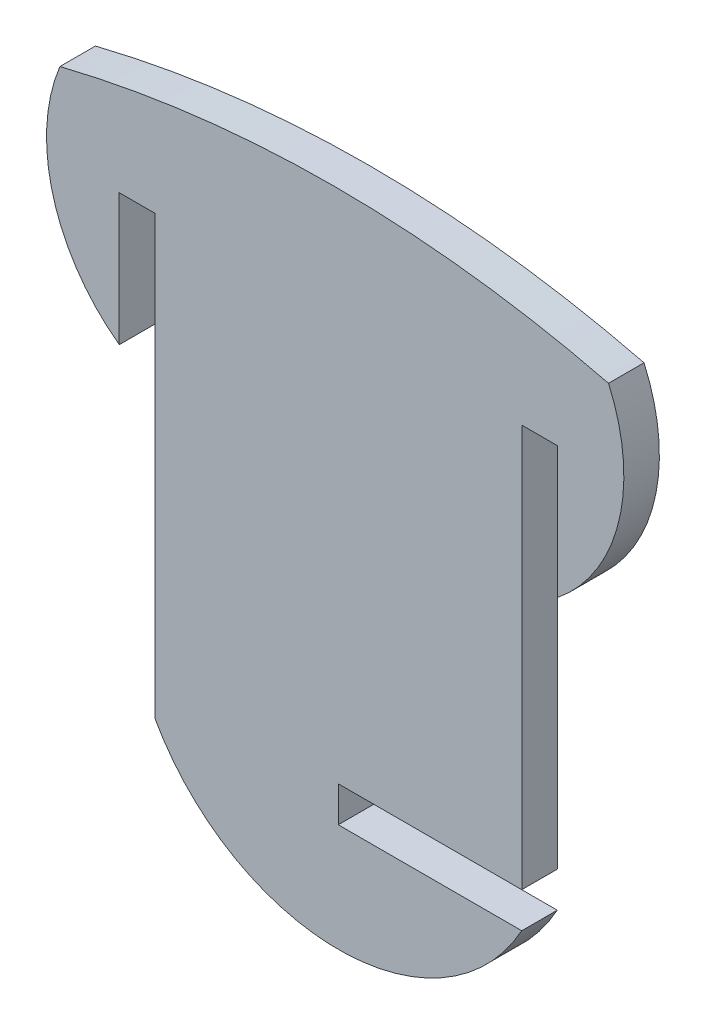
from build123d import *

# Parameters (mm, degrees)
BASE_EXTRUDE_DEPTH = 3


with BuildPart() as part:
    # Sketch1 → Base-Extrude (new body)
    with BuildSketch(Plane.XY):
        with BuildLine():
            Line((327.434465654, 72.761168779), (327.434465654, 61.638791555))
            ThreePointArc((327.434465654, 61.638791555), (332.635220006, 69.823914354), (331.761917416, 79.482145231))
            ThreePointArc((331.761917416, 79.482145231), (308.592008451, 82.313990162), (285.421828233, 79.484365486))
            ThreePointArc((285.421828233, 79.484365486), (284.853925586, 69.698061489), (290.434465654, 61.638791555))
            Line((290.434465654, 61.638791555), (290.434465654, 72.761168779))
            Line((290.434465654, 72.761168779), (293.434465654, 72.761168779))
            Line((293.434465654, 72.761168779), (293.434465654, 35.847162793))
            ThreePointArc((293.434465654, 35.847162793), (308.912610373, 26.65368117), (324.434465654, 35.773170023))
            Line((324.434465654, 35.773170023), (308.934465654, 35.773170023))
            Line((308.934465654, 35.773170023), (308.934465654, 38.773170023))
            Line((308.934465654, 38.773170023), (324.434465654, 38.773170023))
            Line((324.434465654, 38.773170023), (324.434465654, 72.761168779))
            Line((324.434465654, 72.761168779), (327.434465654, 72.761168779))
        make_face()
    extrude(amount=BASE_EXTRUDE_DEPTH)


solid = part.part
